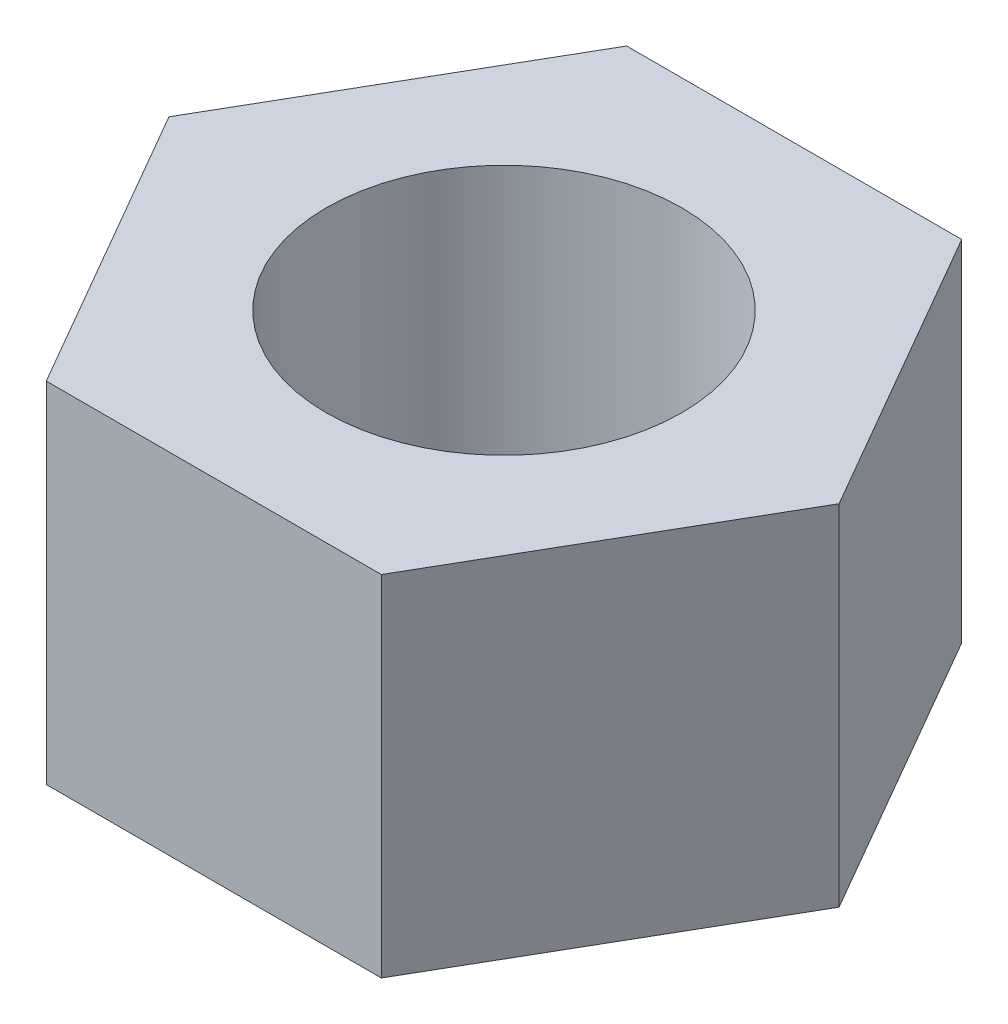
from build123d import *

# Parameters (mm, degrees)
SKETCH_1_R      = 3
EXTRUDE_1_DEPTH = 5.9


with BuildPart() as part:
    # 草图1 → 凸台-拉伸1 (new body)
    with BuildSketch(Plane(origin=(0, 0, 0), x_dir=(1, 0, 0), z_dir=(0, 1, 0))):
        Polygon((5.658032638, 0), (2.829016319, 4.9), (-2.829016319, 4.9), (-5.658032638, 0), (-2.829016319, -4.9), (2.829016319, -4.9), align=None)
        with Locations(Location((0, 0, 0), (0, 0, 270))):
            Circle(SKETCH_1_R, mode=Mode.SUBTRACT)
    extrude(amount=EXTRUDE_1_DEPTH)


solid = part.part
